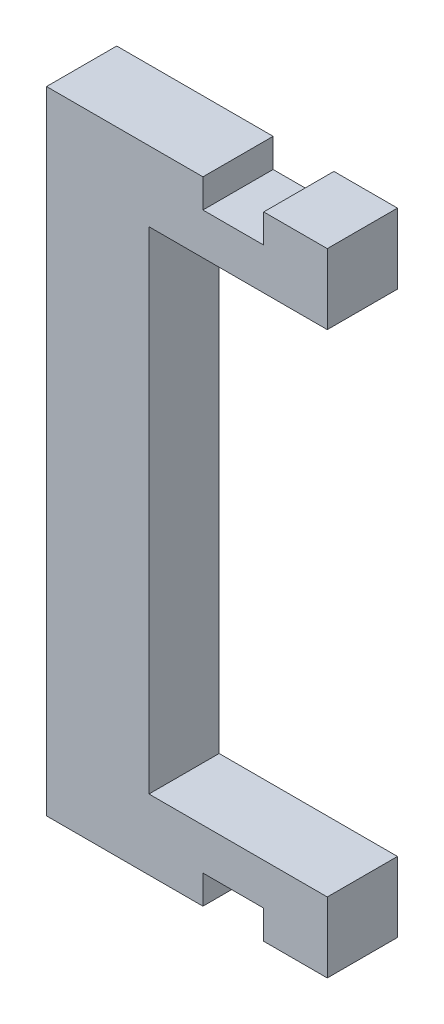
from build123d import *

# Parameters (mm, degrees)
BOSS_EXTRUDE1_DEPTH = 25.4


with BuildPart() as part:
    # Sketch1 → Boss-Extrude1 (new body)
    with BuildSketch(Plane(origin=(0, 0, 0), x_dir=(0, 1, 0), z_dir=(0, 0, 1))):
        Polygon((0, 23), (0, 0), (25.4, 0), (25.4, 64.530536968), (203.2, 64.530536968), (203.2, 0), (228.6, 0), (228.6, 23), (218.2, 23), (218.2, 45), (228.6, 45), (228.6, 101.6), (0, 101.6), (0, 45), (10.4, 45), (10.4, 23), align=None)
    extrude(amount=BOSS_EXTRUDE1_DEPTH)


solid = part.part
